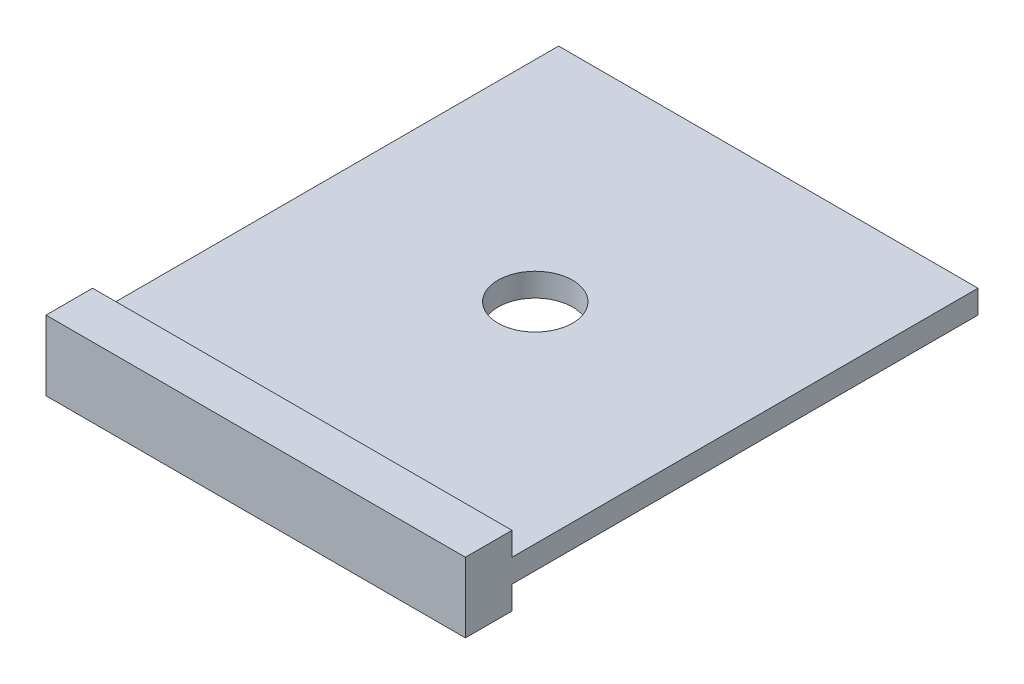
from build123d import *

# Parameters (mm, degrees)
SKETCH1_W           = 18
SKETCH1_H           = 20
BOSS_EXTRUDE1_DEPTH = 1
SKETCH2_W           = 18
SKETCH2_H           = 3
BOSS_EXTRUDE2_DEPTH = 2
SKETCH3_R           = 1.6
CUT_EXTRUDE1_DEPTH  = 27.981475126


with BuildPart() as part:
    # Sketch1 → Boss-Extrude1 (new body)
    with BuildSketch(Plane(origin=(0, 0, 0), x_dir=(1, 0, 0), z_dir=(0, 1, 0))):
        with Locations((9, 10)):
            Rectangle(SKETCH1_W, SKETCH1_H)
    extrude(amount=BOSS_EXTRUDE1_DEPTH)

    # Sketch2 → Boss-Extrude2 (add)
    with BuildSketch(Plane.XY):
        with Locations((9, 0.5)):
            Rectangle(SKETCH2_W, SKETCH2_H)
    extrude(amount=BOSS_EXTRUDE2_DEPTH)

    # Sketch3 → Cut-Extrude1 (cut, through all)
    with BuildSketch(Plane(origin=(0, 1, 0), x_dir=(1, 0, 0), z_dir=(0, 1, 0))):
        with Locations(Location((9, 10, 0), (0, 0, 270))):
            Circle(SKETCH3_R)
    extrude(amount=-CUT_EXTRUDE1_DEPTH, mode=Mode.SUBTRACT)


solid = part.part
